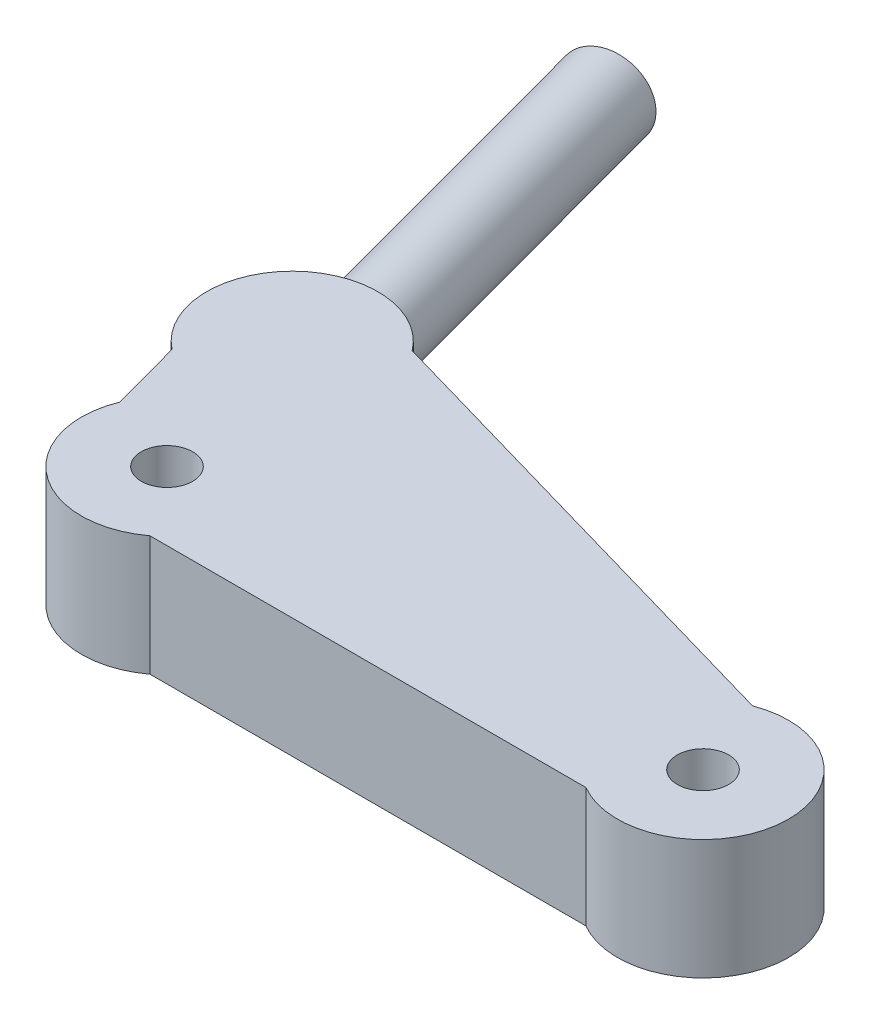
from build123d import *

# Parameters (mm, degrees)
CROQUIS1_R                   = 1.5
SALIENTE_EXTRUIR1_DEPTH      = 7
SALIENTE_EXTRUIR3_DEPTH      = 21
SALIENTE_EXTRUIR3_DEPTH_BACK = 3
CROQUIS3_R                   = 2.35


with BuildPart() as part:
    # Croquis1 → Saliente-Extruir1 (new body)
    with BuildSketch(Plane(origin=(0, 0, 0), x_dir=(1, 0, 0), z_dir=(0, 1, 0))):
        with BuildLine():
            Line((12.967669222, -4), (-12.4902, -4))
            ThreePointArc((-12.4902, -4), (-18.53478474, -3.968671916), (-20.133802427, 1.860661543))
            Line((-20.133802427, 1.860661543), (-21.263589404, 6.064668523))
            ThreePointArc((-21.263589404, 6.064668523), (-21.68376794, 13.566277491), (-14.19064257, 13.015133868))
            Line((-14.19064257, 13.015133868), (13.709196644, 4.992255837))
            ThreePointArc((13.709196644, 4.992255837), (20.470001725, -0.091961868), (12.967669222, -4))
        make_face()
        with Locations(Location((-15.491842215, 0, 0), (0, 0, 270))):
            Circle(CROQUIS1_R, mode=Mode.SUBTRACT)
        with Locations(Location((15.486915831, 0.318957805, 0), (0, 0, 90))):
            Circle(CROQUIS1_R, mode=Mode.SUBTRACT)
    extrude(amount=SALIENTE_EXTRUIR1_DEPTH)

    # Croquis3 → Saliente-Extruir3 (add, two sides: drawn at the far end of the back side and taken through both)
    with BuildSketch(Plane(origin=(-5.028546726, 0, -18.711532324), x_dir=(-0.9657345126344663, 0, 0.25953198474690947), z_dir=(-0.2595319847469094, 0, -0.9657345126344662)).offset(-SALIENTE_EXTRUIR3_DEPTH_BACK)):
        with Locations((14.961006691, 3.5)):
            Circle(CROQUIS3_R)
    extrude(amount=SALIENTE_EXTRUIR3_DEPTH + SALIENTE_EXTRUIR3_DEPTH_BACK)


solid = part.part
